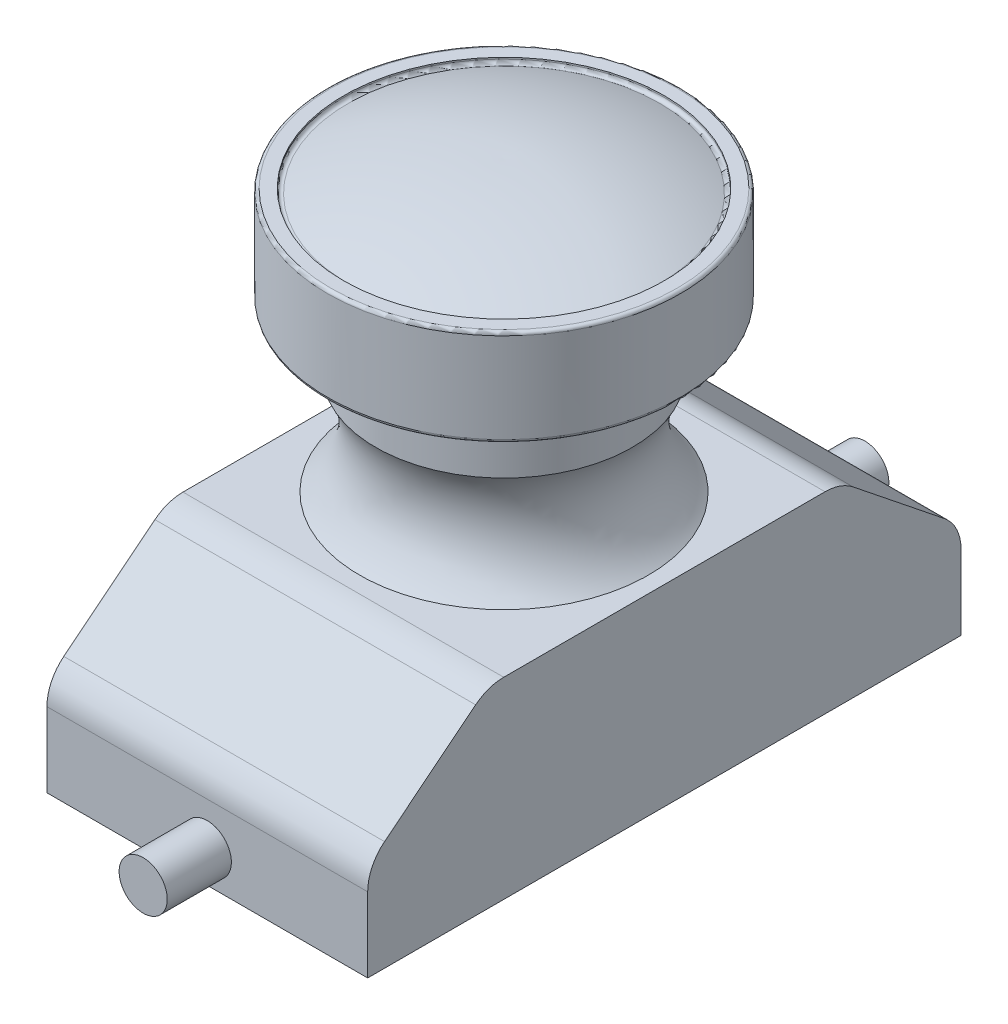
from build123d import *

# Parameters (mm, degrees)
EXTRUDE_1_DEPTH = 5
FILLET_1_R      = 0.1
FILLET_2_R      = 0.1
FILLET_3_R      = 1.4
SKETCH_4_R      = 0.75
EXTRUDE_3_DEPTH = 2


with BuildPart() as part:
    # 草图1 → 凸台-拉伸1 (new, symmetric)
    with BuildSketch(Plane(origin=(0, 0, 0), x_dir=(0, 0, -1), z_dir=(1, 0, 0))):
        Polygon((-9.25, 0), (9.25, 0), (9.25, 3), (5.5, 6), (-5.5, 6), (-9.25, 3), align=None)
    extrude(amount=EXTRUDE_1_DEPTH, both=True)

    # 草图2 → 旋转1 (revolve)
    with BuildSketch(Plane(origin=(0, 0, 0), x_dir=(0, 0, -1), z_dir=(1, 0, 0))):
        with BuildLine():
            Line((0, 6), (0, 14))
            Line((0, 14), (5, 14))
            Line((5, 14), (5, 14.2))
            Line((5, 14.2), (5.5, 14.2))
            Line((5.5, 14.2), (5.5, 11.2))
            Line((5.5, 11.2), (4, 11.2))
            Line((4, 11.2), (4, 9.2))
            ThreePointArc((4, 9.2), (3.661737334, 7.508083958), (4.5, 6))
            Line((4.5, 6), (0, 6))
        make_face()
    revolve(axis=Axis((0, 6, 0), (0, 1, 0)))

    # 草图3 → 旋转2 (revolve)
    with BuildSketch(Plane(origin=(0, 0, 0), x_dir=(0, 0, -1), z_dir=(1, 0, 0))):
        with BuildLine():
            Line((0, 14.2), (0, 15))
            ThreePointArc((0, 15), (-2.553728094, 14.768640471), (-5, 14))
            Line((-5, 14), (0, 14))
            Line((0, 14), (0, 14.2))
        make_face()
    revolve(axis=Axis((0, 14.2, 0), (0, 1, 0)))

    # 圆角1
    fillet_1_edges = [part.edges().sort_by_distance(p)[0] for p in [
        (0, 11.2, 5.5),
        (0, 14.2, 5.5),
    ]]
    fillet(fillet_1_edges, radius=FILLET_1_R)

    # 圆角2
    fillet_2_edges = [part.edges().sort_by_distance(p)[0] for p in [
        (5, 14, 0),
    ]]
    fillet(fillet_2_edges, radius=FILLET_2_R)

    # 圆角3
    fillet_3_edges = [part.edges().sort_by_distance(p)[0] for p in [
        (0, 3, 9.25),
        (0, 6, 5.5),
        (0, 6, -5.5),
        (0, 3, -9.25),
    ]]
    fillet(fillet_3_edges, radius=FILLET_3_R)

    # 草图4 → 凸台-拉伸3 (add)
    with BuildSketch(Plane(origin=(0, 0, -9.25), x_dir=(-1, 0, 0), z_dir=(0, 0, -1))):
        with Locations(Location((0, 1, 0), (0, 0, 270))):
            Circle(SKETCH_4_R)
    extrude_3 = extrude(amount=EXTRUDE_3_DEPTH)

    # 镜向2: 凸台-拉伸3 across plane
    add(extrude_3.mirror(Plane.XY))


solid = part.part
